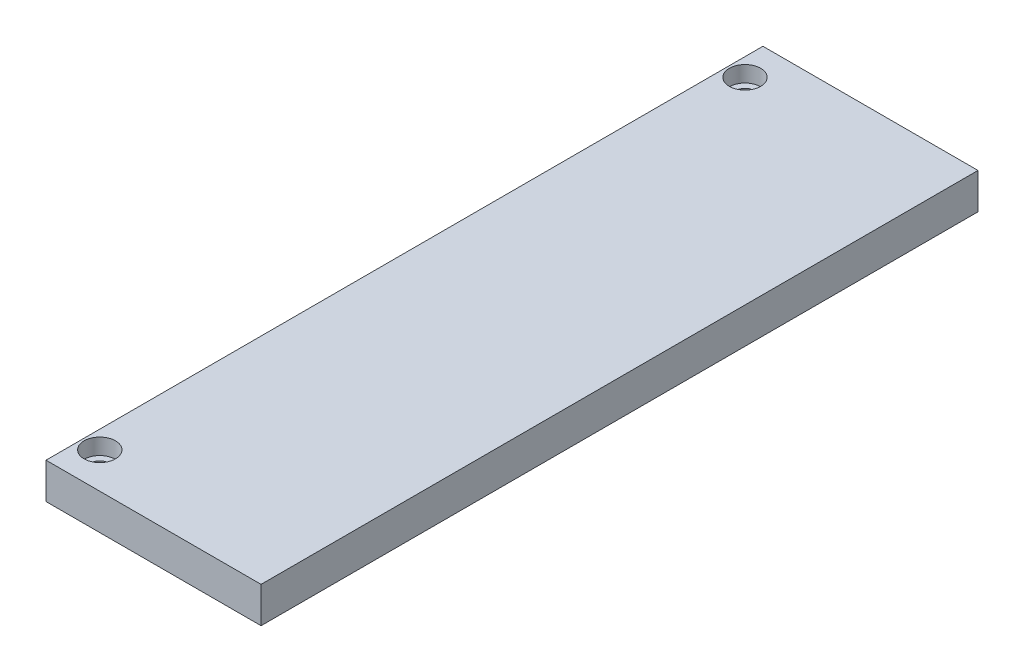
from build123d import *

# Parameters (mm, degrees)
SKETCH1_W                                      = 38.1
SKETCH1_H                                      = 127
BOSS_EXTRUDE1_DEPTH                            = 6.35
CBORE_FOR_4_SOCKET_HEAD_CAP_SCREW1_D           = 3.2639
CBORE_FOR_4_SOCKET_HEAD_CAP_SCREW1_CBORE_D     = 5.55752
CBORE_FOR_4_SOCKET_HEAD_CAP_SCREW1_CBORE_DEPTH = 2.8448


with BuildPart() as part:
    # Sketch1 → Boss-Extrude1 (new body)
    with BuildSketch(Plane(origin=(0, 0, 0), x_dir=(1, 0, 0), z_dir=(0, 1, 0))):
        Rectangle(SKETCH1_W, SKETCH1_H)
    extrude(amount=BOSS_EXTRUDE1_DEPTH)

    # CBORE for #4 Socket Head Cap Screw1 (through all)
    with Locations(Plane(origin=(0, 6.35, 0), x_dir=(1, 0, 0), z_dir=(0, 1, 0))):
        with Locations((-15.875, -57.15), (-15.875, 57.15)):
            CounterBoreHole(CBORE_FOR_4_SOCKET_HEAD_CAP_SCREW1_D / 2, CBORE_FOR_4_SOCKET_HEAD_CAP_SCREW1_CBORE_D / 2, CBORE_FOR_4_SOCKET_HEAD_CAP_SCREW1_CBORE_DEPTH)


solid = part.part
